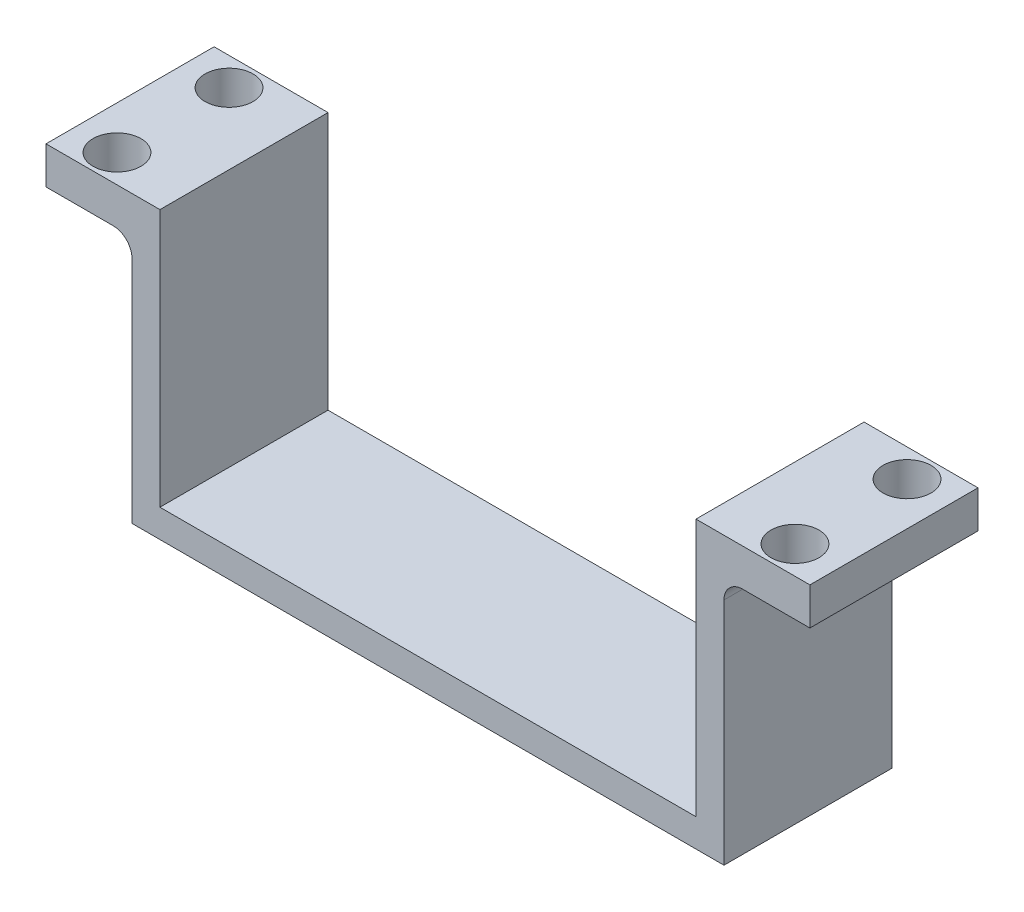
from build123d import *

# Parameters (mm, degrees)
BOSS_EXTRUDE1_DEPTH = 22.86
SKETCH2_W           = 15.494
SKETCH2_H           = 22.86
SKETCH2_R           = 3.2639
BOSS_EXTRUDE2_DEPTH = 5.08
FILLET1_R           = 2.54


with BuildPart() as part:
    # Sketch1 → Boss-Extrude1 (new body)
    with BuildSketch(Plane.XY):
        Polygon((0, 0), (0, -35.052), (72.898, -35.052), (72.898, 0), (76.708, 0), (76.708, -38.862), (-3.81, -38.862), (-3.81, 0), align=None)
    extrude(amount=BOSS_EXTRUDE1_DEPTH)

    # Sketch2 → Boss-Extrude2 (add)
    with BuildSketch(Plane(origin=(0, 0, 0), x_dir=(1, 0, 0), z_dir=(0, 1, 0))):
        with Locations((-7.747, -11.43)):
            Rectangle(SKETCH2_W, SKETCH2_H)
        with Locations(Location((-9.652, -3.81, 0), (0, 0, 270))):
            Circle(SKETCH2_R, mode=Mode.SUBTRACT)
        with Locations(Location((-9.652, -19.05, 0), (0, 0, 270))):
            Circle(SKETCH2_R, mode=Mode.SUBTRACT)
    boss_extrude2 = extrude(amount=-BOSS_EXTRUDE2_DEPTH)

    # Mirror1: Boss-Extrude2 across plane
    add(boss_extrude2.mirror(Plane(origin=(36.449, 0, 0), x_dir=(0, 0, 1), z_dir=(1, 0, 0))))

    # Fillet1
    fillet1_edges = [part.edges().sort_by_distance(p)[0] for p in [
        (-3.81, -5.08, 11.43),
        (76.708, -5.08, 11.43),
    ]]
    fillet(fillet1_edges, radius=FILLET1_R)


solid = part.part
